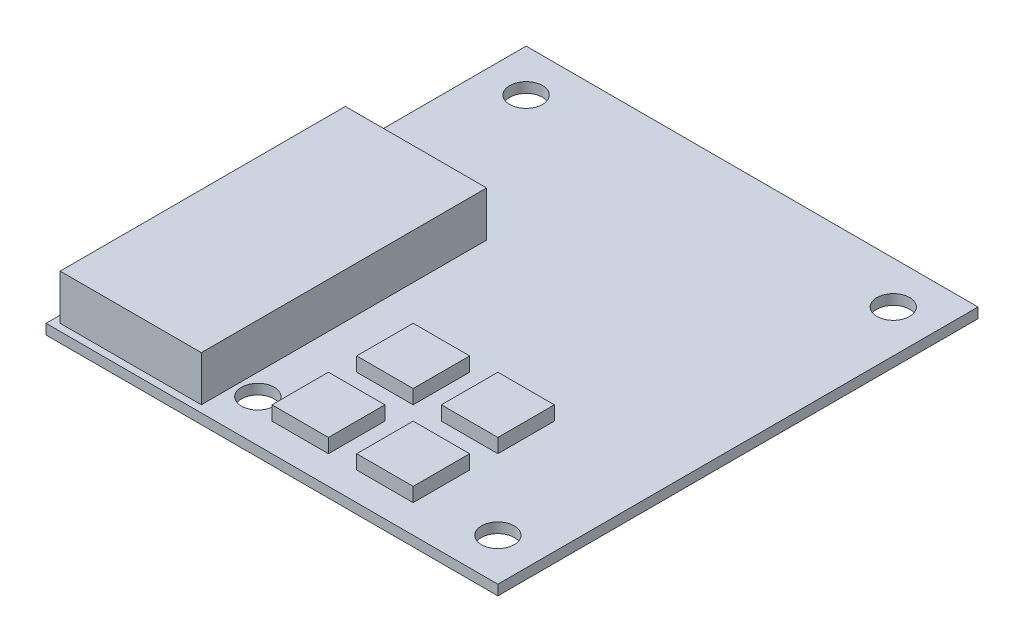
from build123d import *

# Parameters (mm, degrees)
SKETCH1_W                       = 40.64
SKETCH1_H                       = 43.18
BOSS_EXTRUDE1_DEPTH             = 0.9144
SKETCH3_W                       = 5.08
SKETCH3_H                       = 5.08
BOSS_EXTRUDE2_DEPTH             = 1.27
SKETCH4_W                       = 12.7
SKETCH4_H                       = 25.654
BOSS_EXTRUDE3_DEPTH             = 4.064
F_32_0_116_DIAMETER_HOLE1_D     = 2.9464
F_32_0_116_DIAMETER_HOLE1_DEPTH = 25.4
F_32_0_116_DIAMETER_HOLE1_TIP   = 0.885187864


with BuildPart() as part:
    # Sketch1 → Boss-Extrude1 (new body)
    with BuildSketch(Plane(origin=(0, 0, 0), x_dir=(1, 0, 0), z_dir=(0, 1, 0))):
        with Locations((20.32, 21.59)):
            Rectangle(SKETCH1_W, SKETCH1_H)
    extrude(amount=BOSS_EXTRUDE1_DEPTH)

    # Sketch3 → Boss-Extrude2 (add)
    with BuildSketch(Plane(origin=(0, 0.9144, 0), x_dir=(1, 0, 0), z_dir=(0, 1, 0))):
        with Locations((20.32, 12.7)):
            Rectangle(SKETCH3_W, SKETCH3_H)
        with Locations((27.94, 12.7)):
            Rectangle(SKETCH3_W, SKETCH3_H)
        with Locations((27.94, 5.08)):
            Rectangle(SKETCH3_W, SKETCH3_H)
        with Locations((20.32, 5.08)):
            Rectangle(SKETCH3_W, SKETCH3_H)
    extrude(amount=BOSS_EXTRUDE2_DEPTH)

    # Sketch4 → Boss-Extrude3 (add)
    with BuildSketch(Plane(origin=(0, 0.9144, 0), x_dir=(1, 0, 0), z_dir=(0, 1, 0))):
        with Locations((6.985, 13.462)):
            Rectangle(SKETCH4_W, SKETCH4_H)
    extrude(amount=BOSS_EXTRUDE3_DEPTH)

    # #32 (0.116) Diameter Hole1
    with Locations(Plane(origin=(0, 0.9144, 0), x_dir=(1, 0, 0), z_dir=(0, 1, 0))):
        with Locations((3.81, 39.37), (36.83, 39.37), (36.83, 3.81), (15.24, 3.81)):
            Hole(F_32_0_116_DIAMETER_HOLE1_D / 2, depth=F_32_0_116_DIAMETER_HOLE1_DEPTH)
            with Locations((0, 0, -(F_32_0_116_DIAMETER_HOLE1_DEPTH + F_32_0_116_DIAMETER_HOLE1_TIP / 2))):  # 118° drill point
                Cone(0, F_32_0_116_DIAMETER_HOLE1_D / 2, F_32_0_116_DIAMETER_HOLE1_TIP, mode=Mode.SUBTRACT)


solid = part.part
